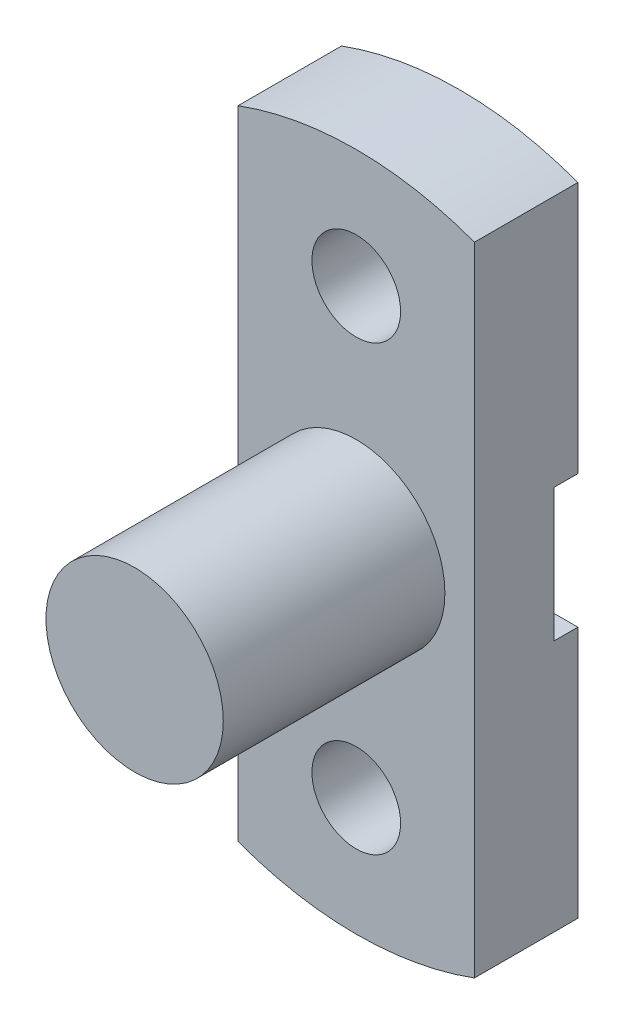
from build123d import *

# Parameters (mm, degrees)
SKETCH1_R           = 15
BOSS_EXTRUDE1_DEPTH = 35
SKETCH3_W           = 8
SKETCH3_H           = 45
CUT_EXTRUDE1_DEPTH  = 115
SKETCH5_R           = 30
BOSS_EXTRUDE2_DEPTH = 75


with BuildPart() as part:
    # Sketch1 → Boss-Extrude1 (new body)
    with BuildSketch(Plane.XY):
        with BuildLine():
            Line((-40, 107.819293264), (-40, -107.819293264))
            ThreePointArc((-40, -107.819293264), (0, -115), (40, -107.819293264))
            Line((40, -107.819293264), (40, 107.819293264))
            ThreePointArc((40, 107.819293264), (0, 115), (-40, 107.819293264))
        make_face()
        with Locations((0, 75)):
            Circle(SKETCH1_R, mode=Mode.SUBTRACT)
        with Locations((0, -75)):
            Circle(SKETCH1_R, mode=Mode.SUBTRACT)
    extrude(amount=BOSS_EXTRUDE1_DEPTH)

    # Sketch3 → Cut-Extrude1 (cut)
    with BuildSketch(Plane(origin=(40, 0, 0), x_dir=(0, 0, -1), z_dir=(1, 0, 0))):
        with Locations((-4, 0)):
            Rectangle(SKETCH3_W, SKETCH3_H)
    extrude(amount=-CUT_EXTRUDE1_DEPTH, mode=Mode.SUBTRACT)

    # Sketch5 → Boss-Extrude2 (add)
    with BuildSketch(Plane.XY.offset(35)):
        Circle(SKETCH5_R)
    extrude(amount=BOSS_EXTRUDE2_DEPTH)


solid = part.part
